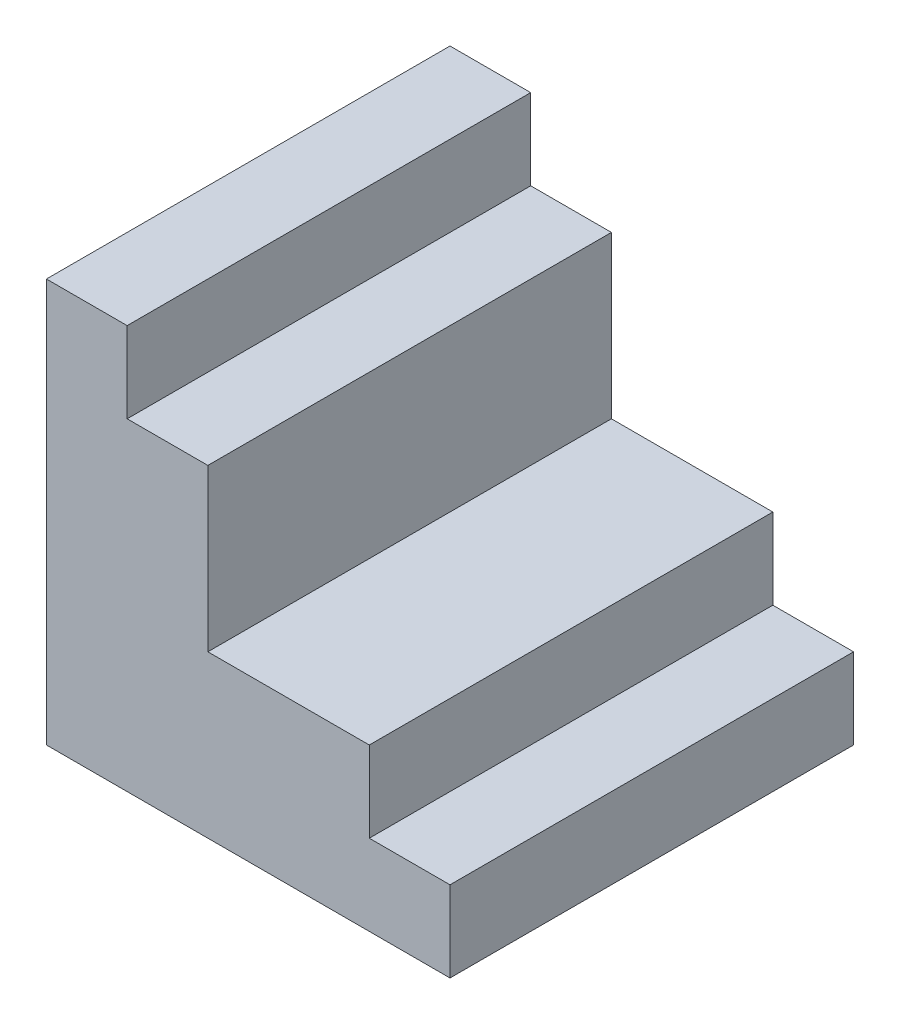
from build123d import *

# Parameters (mm, degrees)
BOSS_EXTRUDE1_DEPTH = 5


with BuildPart() as part:
    # Sketch1 → Boss-Extrude1 (new, symmetric)
    with BuildSketch(Plane.XY):
        Polygon((-5, 10), (-5, 0), (5, 0), (5, 2), (3, 2), (3, 4), (-1, 4), (-1, 8), (-3, 8), (-3, 10), align=None)
    extrude(amount=BOSS_EXTRUDE1_DEPTH, both=True)


solid = part.part
